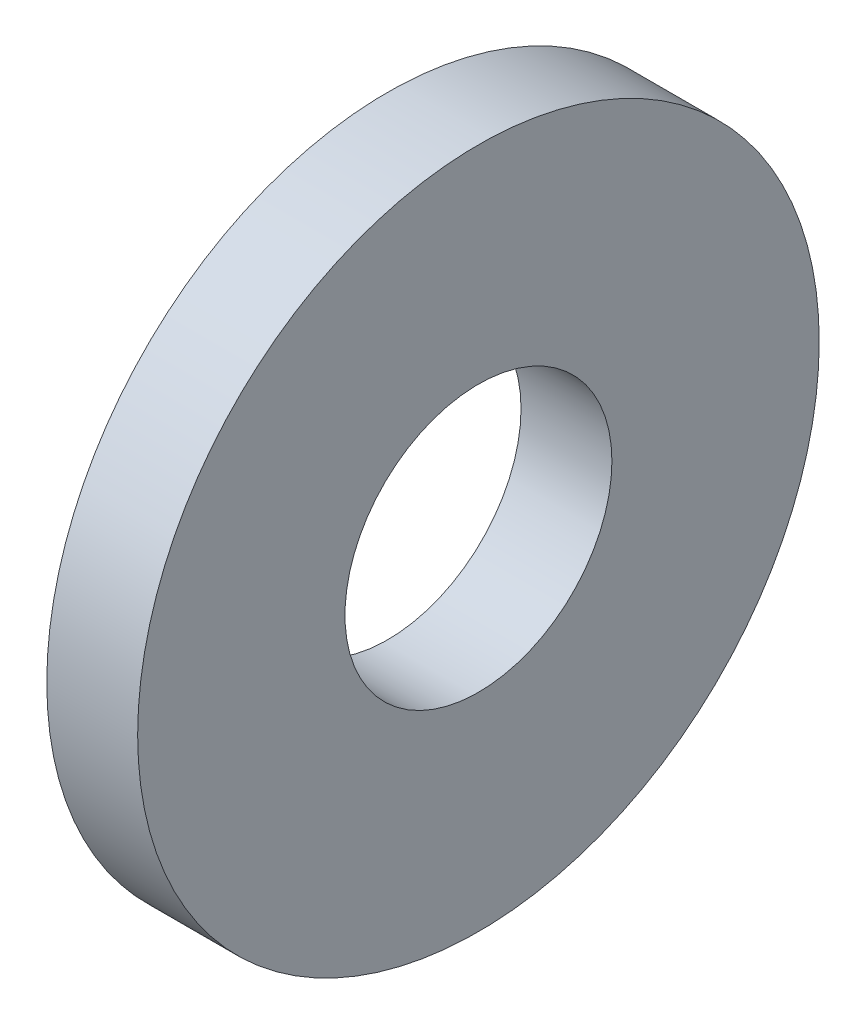
from build123d import *

# Parameters (mm, degrees)
SKETCH1_R          = 6
SKETCH1_R_2        = 2.35
BASE_EXTRUDE_DEPTH = 1.6


with BuildPart() as part:
    # Sketch1 → Base-Extrude (new body)
    with BuildSketch(Plane(origin=(0, 0, 0), x_dir=(0, 0, -1), z_dir=(1, 0, 0))):
        Circle(SKETCH1_R)
        Circle(SKETCH1_R_2, mode=Mode.SUBTRACT)
    extrude(amount=BASE_EXTRUDE_DEPTH)


solid = part.part
